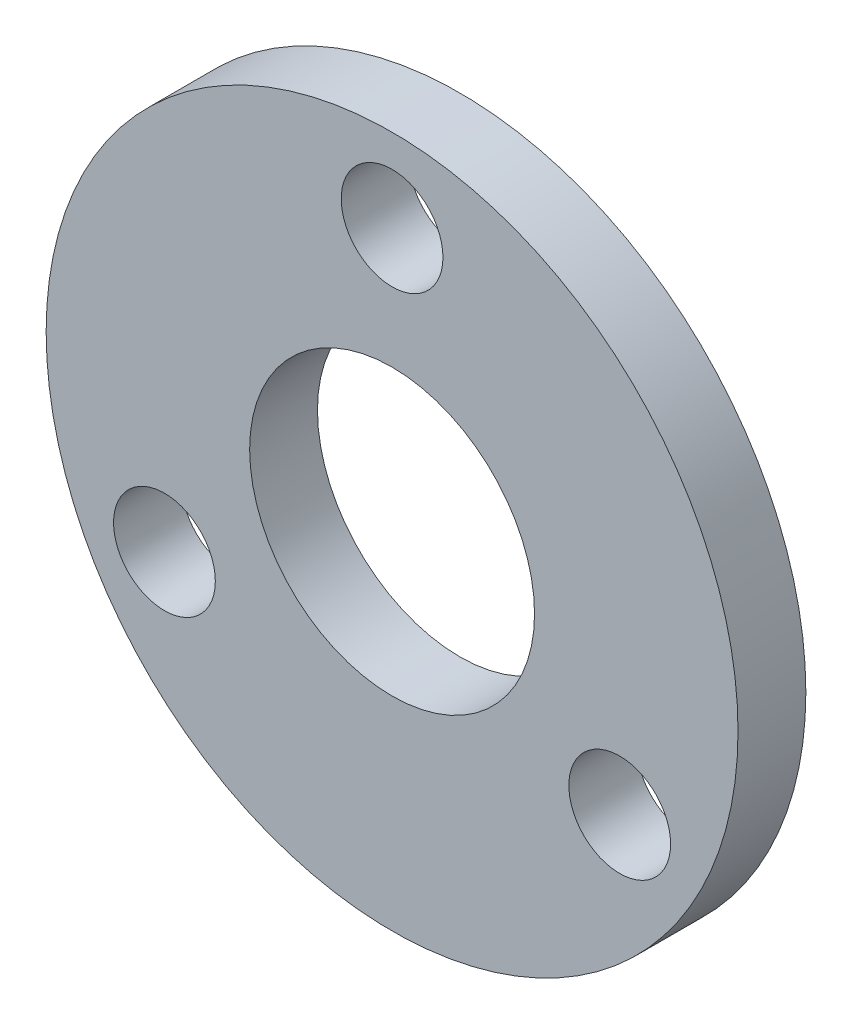
from build123d import *

# Parameters (mm, degrees)
SKETCH_1_R      = 10.2
SKETCH_1_R_2    = 1.5
SKETCH_1_R_3    = 4.2
EXTRUDE_1_DEPTH = 1


with BuildPart() as part:
    # Эскиз1 → Бобышка-Вытянуть1 (new, symmetric)
    with BuildSketch(Plane.XY):
        Circle(SKETCH_1_R)
        with Locations((-6.711696879, -3.875)):
            Circle(SKETCH_1_R_2, mode=Mode.SUBTRACT)
        with Locations((0, 7.75)):
            Circle(SKETCH_1_R_2, mode=Mode.SUBTRACT)
        with Locations((6.711696879, -3.875)):
            Circle(SKETCH_1_R_2, mode=Mode.SUBTRACT)
        Circle(SKETCH_1_R_3, mode=Mode.SUBTRACT)
    extrude(amount=EXTRUDE_1_DEPTH, both=True)


solid = part.part
